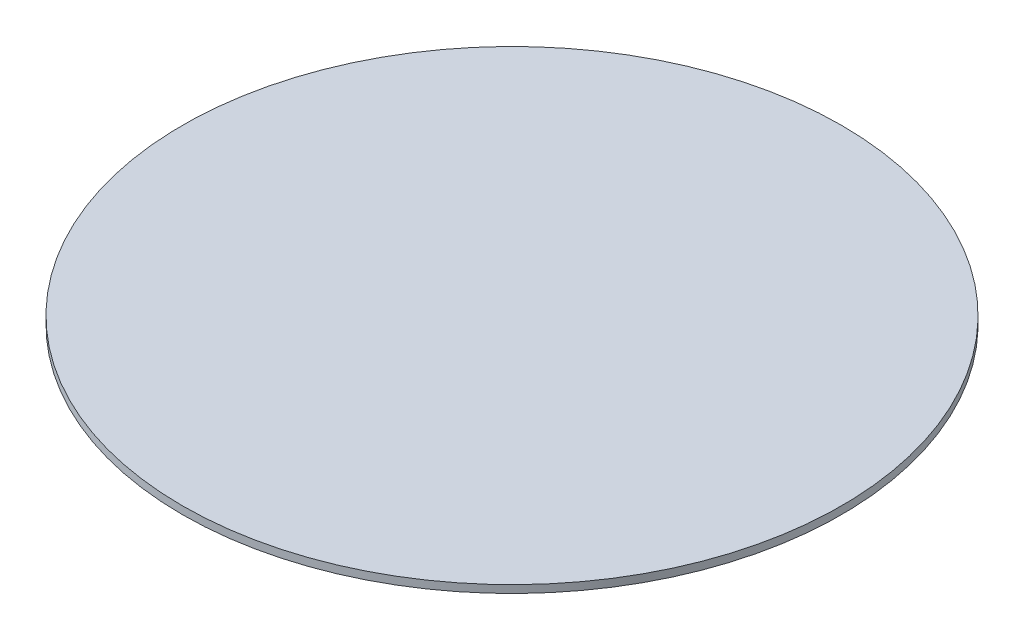
from build123d import *

# Parameters (mm, degrees)
SKETCH1_R           = 76.2
BOSS_EXTRUDE1_DEPTH = 1.778


with BuildPart() as part:
    # Sketch1 → Boss-Extrude1 (new body)
    with BuildSketch(Plane(origin=(0, 0, 0), x_dir=(1, 0, 0), z_dir=(0, 1, 0))):
        with Locations(Location((0, 0, 0), (0, 0, 270))):
            Circle(SKETCH1_R)
    extrude(amount=BOSS_EXTRUDE1_DEPTH)


solid = part.part
